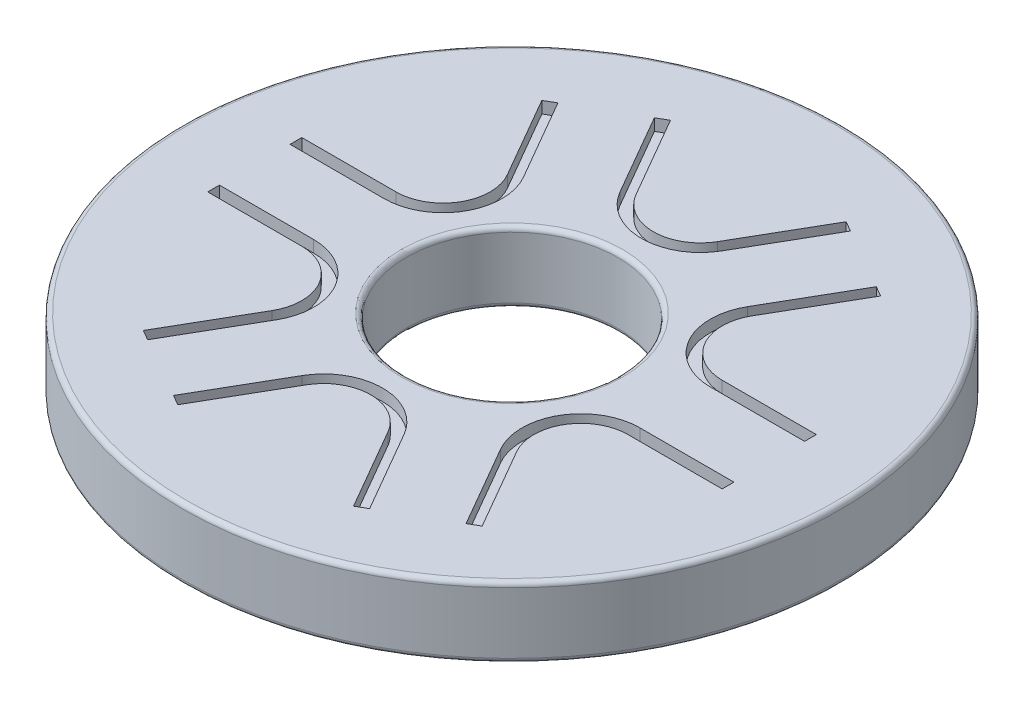
from build123d import *

# Parameters (mm, degrees)
SKETCH1_R           = 14
SKETCH1_R_2         = 4.5
BOSS_EXTRUDE1_DEPTH = 3
CUT_EXTRUDE1_DEPTH  = 0.5
FILLET1_R           = 0.2


with BuildPart() as part:
    # Sketch1 → Boss-Extrude1 (new body)
    with BuildSketch(Plane(origin=(0, 0, 0), x_dir=(1, 0, 0), z_dir=(0, 1, 0))):
        with Locations(Location((0, 0, 0), (0, 0, 270))):
            Circle(SKETCH1_R)
        with Locations(Location((0, 0, 0), (0, 0, 270))):
            Circle(SKETCH1_R_2, mode=Mode.SUBTRACT)
    extrude(amount=BOSS_EXTRUDE1_DEPTH)

    # Sketch2 → Cut-Extrude1 (cut)
    with BuildSketch(Plane(origin=(0, 3, 0), x_dir=(1, 0, 0), z_dir=(0, 1, 0))):
        with BuildLine():
            Line((-2.165063509, 6.75), (-4.165063509, 10.214101615))
            Line((-4.165063509, 10.214101615), (-3.732050808, 10.464101615))
            Line((-3.732050808, 10.464101615), (-1.732050808, 7))
            ThreePointArc((-1.732050808, 7), (0, 6), (1.732050808, 7))
            Line((1.732050808, 7), (3.732050808, 10.464101615))
            Line((3.732050808, 10.464101615), (4.165063509, 10.214101615))
            Line((4.165063509, 10.214101615), (2.165063509, 6.75))
            ThreePointArc((2.165063509, 6.75), (0, 5.5), (-2.165063509, 6.75))
        make_face()
        with BuildLine():
            Line((5.196152423, 5), (7.196152423, 8.464101615))
            Line((7.196152423, 8.464101615), (6.763139721, 8.714101615))
            Line((6.763139721, 8.714101615), (4.763139721, 5.25))
            ThreePointArc((4.763139721, 5.25), (4.763139721, 2.75), (6.92820323, 1.5))
            Line((6.92820323, 1.5), (10.92820323, 1.5))
            Line((10.92820323, 1.5), (10.92820323, 2))
            Line((10.92820323, 2), (6.92820323, 2))
            ThreePointArc((6.92820323, 2), (5.196152423, 3), (5.196152423, 5))
        make_face()
        with BuildLine():
            Line((6.92820323, -2), (10.92820323, -2))
            Line((10.92820323, -2), (10.92820323, -1.5))
            Line((10.92820323, -1.5), (6.92820323, -1.5))
            ThreePointArc((6.92820323, -1.5), (4.763139721, -2.75), (4.763139721, -5.25))
            Line((4.763139721, -5.25), (6.763139721, -8.714101615))
            Line((6.763139721, -8.714101615), (7.196152423, -8.464101615))
            Line((7.196152423, -8.464101615), (5.196152423, -5))
            ThreePointArc((5.196152423, -5), (5.196152423, -3), (6.92820323, -2))
        make_face()
        with BuildLine():
            Line((1.732050808, -7), (3.732050808, -10.464101615))
            Line((3.732050808, -10.464101615), (4.165063509, -10.214101615))
            Line((4.165063509, -10.214101615), (2.165063509, -6.75))
            ThreePointArc((2.165063509, -6.75), (0, -5.5), (-2.165063509, -6.75))
            Line((-2.165063509, -6.75), (-4.165063509, -10.214101615))
            Line((-4.165063509, -10.214101615), (-3.732050808, -10.464101615))
            Line((-3.732050808, -10.464101615), (-1.732050808, -7))
            ThreePointArc((-1.732050808, -7), (0, -6), (1.732050808, -7))
        make_face()
        with BuildLine():
            Line((-5.196152423, -5), (-7.196152423, -8.464101615))
            Line((-7.196152423, -8.464101615), (-6.763139721, -8.714101615))
            Line((-6.763139721, -8.714101615), (-4.763139721, -5.25))
            ThreePointArc((-4.763139721, -5.25), (-4.763139721, -2.75), (-6.92820323, -1.5))
            Line((-6.92820323, -1.5), (-10.92820323, -1.5))
            Line((-10.92820323, -1.5), (-10.92820323, -2))
            Line((-10.92820323, -2), (-6.92820323, -2))
            ThreePointArc((-6.92820323, -2), (-5.196152423, -3), (-5.196152423, -5))
        make_face()
        with BuildLine():
            Line((-6.92820323, 2), (-10.92820323, 2))
            Line((-10.92820323, 2), (-10.92820323, 1.5))
            Line((-10.92820323, 1.5), (-6.92820323, 1.5))
            ThreePointArc((-6.92820323, 1.5), (-4.763139721, 2.75), (-4.763139721, 5.25))
            Line((-4.763139721, 5.25), (-6.763139721, 8.714101615))
            Line((-6.763139721, 8.714101615), (-7.196152423, 8.464101615))
            Line((-7.196152423, 8.464101615), (-5.196152423, 5))
            ThreePointArc((-5.196152423, 5), (-5.196152423, 3), (-6.92820323, 2))
        make_face()
    extrude(amount=-CUT_EXTRUDE1_DEPTH, mode=Mode.SUBTRACT)

    # Fillet1
    fillet1_edges = [part.edges().sort_by_distance(p)[0] for p in [
        (0, 0, -14),
        (0, 3, -14),
        (0, 0, -4.5),
        (0, 3, -4.5),
    ]]
    fillet(fillet1_edges, radius=FILLET1_R)


solid = part.part
